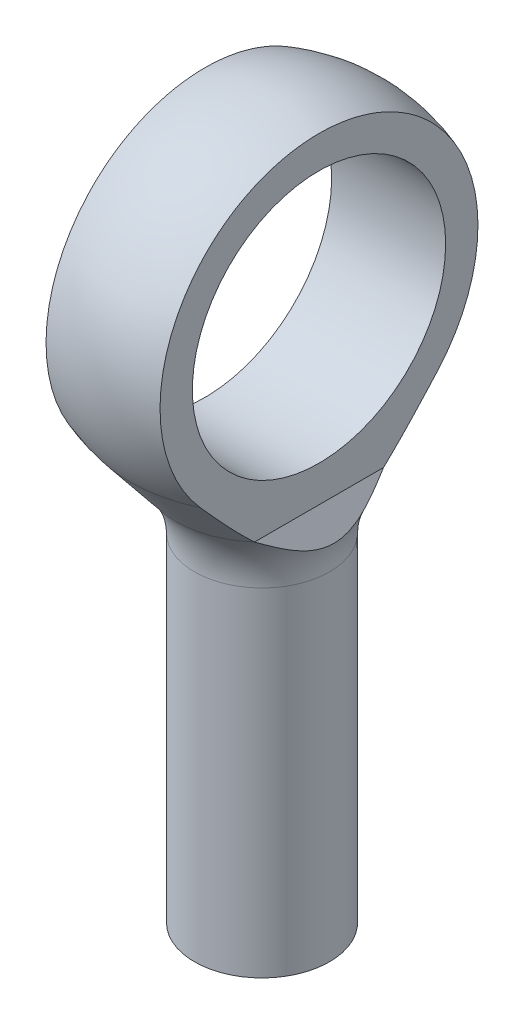
from build123d import *

# Parameters (mm, degrees)
CUT_EXTRUDE4_DEPTH      = 46.034307992
CUT_EXTRUDE4_DEPTH_BACK = 46.034307992
SKETCH3_R               = 7.5
CUT_EXTRUDE5_DEPTH      = 24
SKETCH5_R               = 3
CUT_EXTRUDE6_DEPTH      = 12.7


with BuildPart() as part:
    # Sketch1 → Revolve2 (revolve)
    with BuildSketch(Plane.XY, mode=Mode.PRIVATE) as revolve2_sk:
        with BuildLine():
            Line((0, 0), (0, 42.756156239))
            ThreePointArc((0, 42.756156239), (-9.01476789, 37.08443071), (-7.803677944, 26.502948219))
            Line((-7.803677944, 26.502948219), (-5.098161028, 23.12660401))
            ThreePointArc((-5.098161028, 23.12660401), (-4.282522133, 21.656925638), (-4, 20))
            Line((-4, 20), (-4, 0))
            Line((-4, 0), (0, 0))
        make_face()
    revolve(revolve2_sk.sketch.rotate(Axis((0, 0, 0), (0, 1, 0)), 270), axis=Axis((0, 0, 0), (0, 1, 0)))

    # Sketch2 → Cut-Extrude4 (cut, two sides: drawn at the far end of the back side and taken through both)
    with BuildSketch(Plane.XY.offset(-CUT_EXTRUDE4_DEPTH_BACK)):
        Polygon((-3.375, 42.756156239), (-20, 42.756156239), (-20, -5.668740666), (-3.375, 23.12660401), align=None)
        Polygon((20, 42.756156239), (3.375, 42.756156239), (3.375, 23.12660401), (20, -5.668740666), align=None)
    extrude(amount=CUT_EXTRUDE4_DEPTH + CUT_EXTRUDE4_DEPTH_BACK, mode=Mode.SUBTRACT)

    # Sketch3 → Cut-Extrude5 (cut)
    with BuildSketch(Plane(origin=(3.375, 0, 0), x_dir=(0, 0, -1), z_dir=(1, 0, 0))):
        with Locations((0, 32.756156239)):
            Circle(SKETCH3_R)
    extrude(amount=-CUT_EXTRUDE5_DEPTH, mode=Mode.SUBTRACT)

    # Sketch5 → Cut-Extrude6 (cut)
    with BuildSketch(Plane.XZ):
        with Locations(Location((0, 0, 0), (0, 0, 270))):
            Circle(SKETCH5_R)
    extrude(amount=-CUT_EXTRUDE6_DEPTH, mode=Mode.SUBTRACT)


solid = part.part
